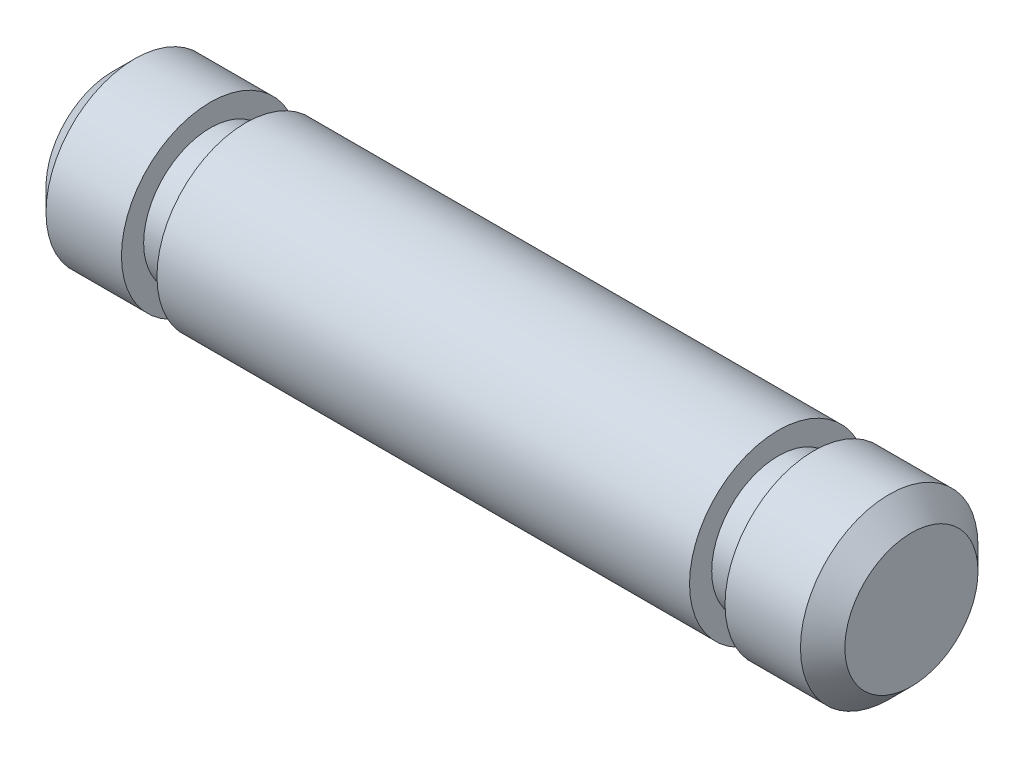
from build123d import *

# Parameters (mm, degrees)
SKETCH1_R           = 2
BOSS_EXTRUDE1_DEPTH = 9
CHAMFER1_SIZE       = 0.5
CUT_EXTRUDE1_START  = -3
SKETCH2_R           = 2
SKETCH2_R_2         = 1.5
CUT_EXTRUDE1_DEPTH  = 0.8


with BuildPart() as part:
    # Sketch1 → Boss-Extrude1 (new, symmetric)
    with BuildSketch(Plane(origin=(0, 0, 0), x_dir=(0, 0, -1), z_dir=(1, 0, 0))):
        Circle(SKETCH1_R)
    extrude(amount=BOSS_EXTRUDE1_DEPTH, both=True)

    # Chamfer1
    chamfer1_edges = [part.edges().sort_by_distance(p)[0] for p in [
        (-9, 0, 2),
        (9, 0, 2),
    ]]
    chamfer(chamfer1_edges, length=CHAMFER1_SIZE)

    # Sketch2 → Cut-Extrude1 (cut)
    with BuildSketch(Plane.ZY.offset(9).offset(CUT_EXTRUDE1_START)):
        Circle(SKETCH2_R)
        Circle(SKETCH2_R_2, mode=Mode.SUBTRACT)
    cut_extrude1 = extrude(amount=CUT_EXTRUDE1_DEPTH, mode=Mode.SUBTRACT)

    # Mirror2: Cut-Extrude1 across plane
    add(cut_extrude1.mirror(Plane(origin=(0, 0, 0), x_dir=(0, 0, 1), z_dir=(1, 0, 0))), mode=Mode.SUBTRACT)


solid = part.part
